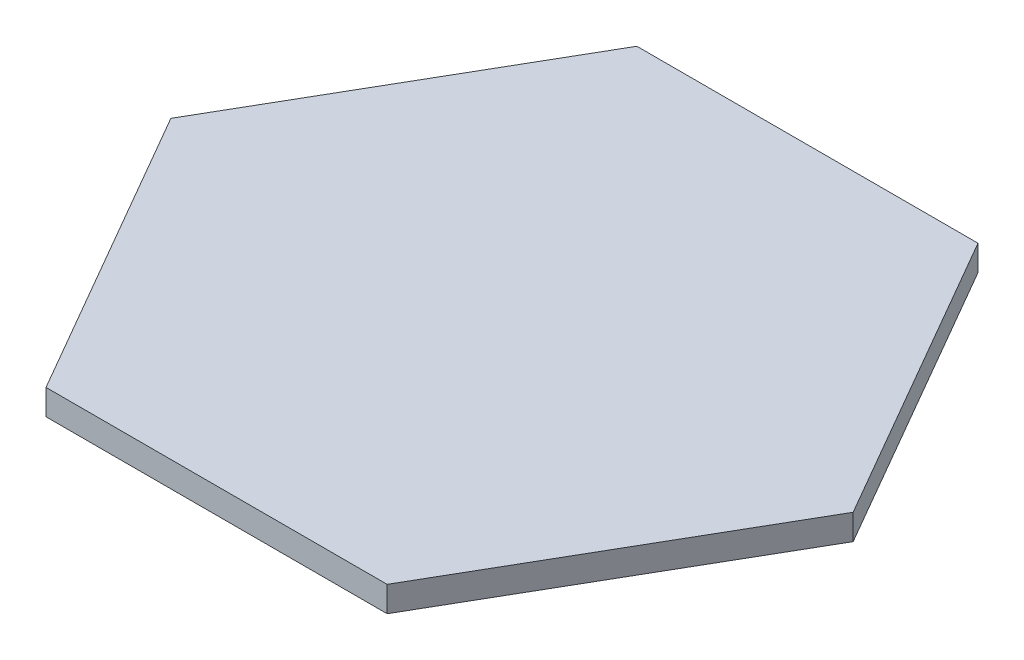
from build123d import *

# Parameters (mm, degrees)
ACRYLIC_BASE_DEPTH = 6.35


with BuildPart() as part:
    # Gel Pad Pattern Sketch → Acrylic Base (new body)
    with BuildSketch(Plane(origin=(0, 0, 0), x_dir=(1, 0, 0), z_dir=(0, 1, 0))):
        Polygon((-42.526279442, -73.65767665), (42.526279442, -73.65767665), (85.052558883, 0), (42.526279442, 73.65767665), (-42.526279442, 73.65767665), (-85.052558883, 0), align=None)
    extrude(amount=ACRYLIC_BASE_DEPTH)


solid = part.part
